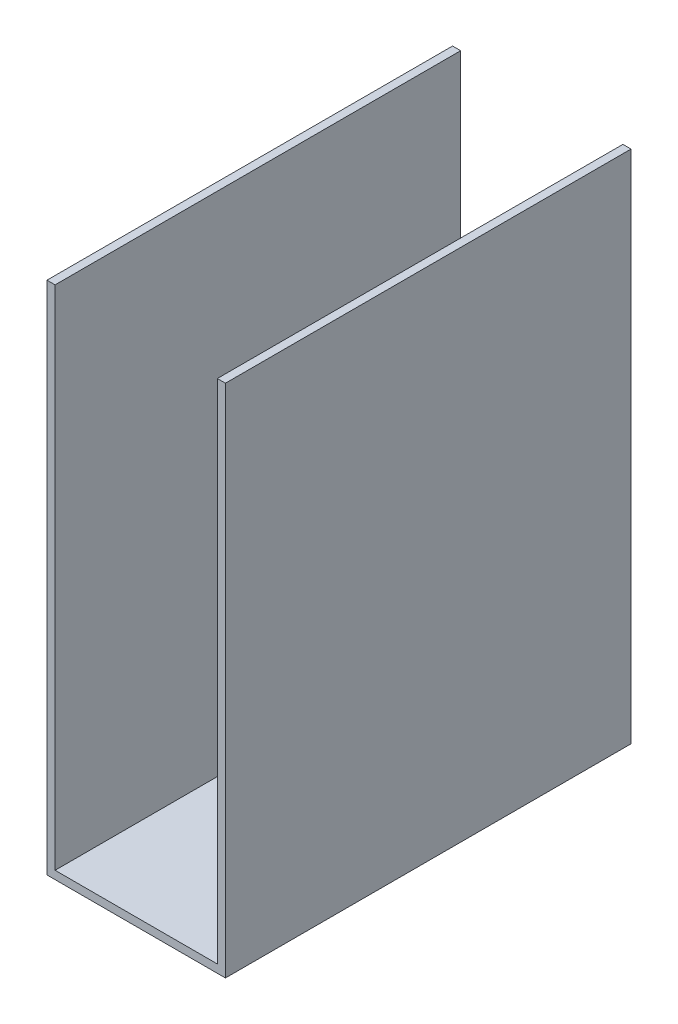
from build123d import *

# Parameters (mm, degrees)
BOSS_EXTRUDE1_DEPTH = 10000


with BuildPart() as part:
    # Sketch2 → Boss-Extrude1 (new body)
    with BuildSketch(Plane.XY):
        Polygon((0, 0), (0, -12500), (4000, -12500), (4000, 0), (4200, 0), (4200, -12700), (-200, -12700), (-200, 0), align=None)
    extrude(amount=-BOSS_EXTRUDE1_DEPTH)


solid = part.part
